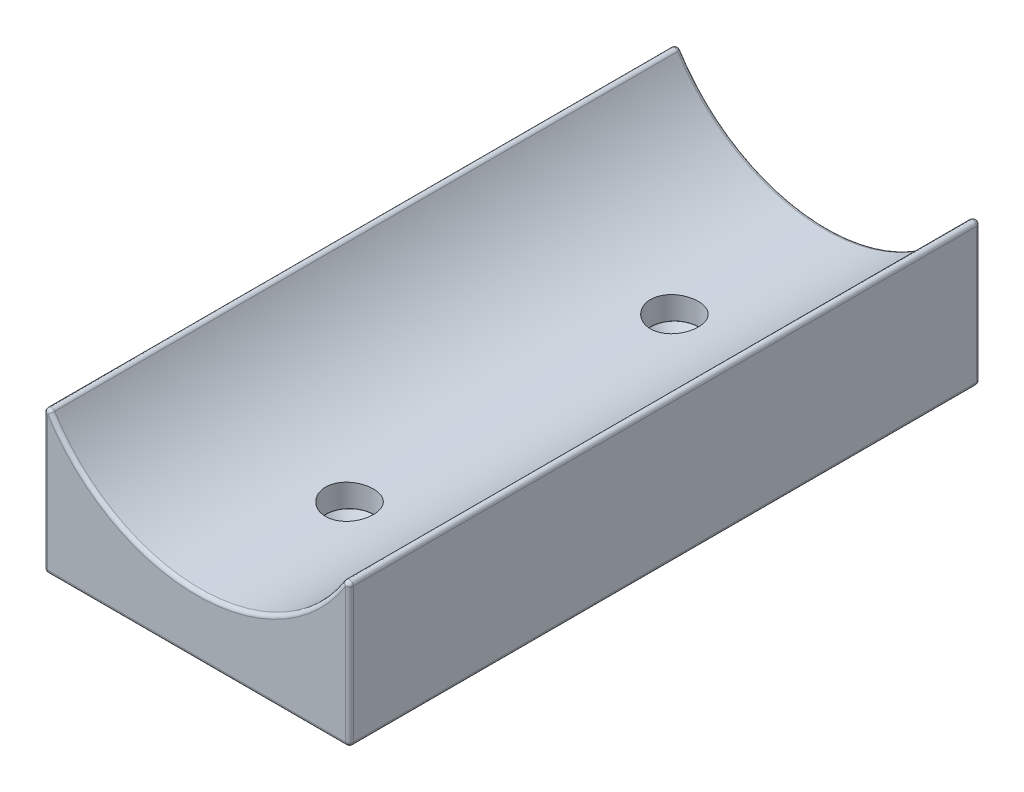
from build123d import *

# Parameters (mm, degrees)
BOSS_EXTRUDE1_DEPTH                                 = 83.82
FILLET1_R                                           = 0.508
CUT_EXTRUDE1_START                                  = 5.08
SKETCH5_R                                           = 3.175
CUT_EXTRUDE1_DEPTH                                  = 90.986026172
CSK_FOR_M3_COUNTERSUNK_FLAT_HEAD_SCREW1_D           = 3.6
CSK_FOR_M3_COUNTERSUNK_FLAT_HEAD_SCREW1_DEPTH       = 419.354
CSK_FOR_M3_COUNTERSUNK_FLAT_HEAD_SCREW1_CSINK_D     = 6.3
CSK_FOR_M3_COUNTERSUNK_FLAT_HEAD_SCREW1_CSINK_ANGLE = 90
CSK_FOR_M3_COUNTERSUNK_FLAT_HEAD_SCREW1_TIP         = 1.081549114
FILLET2_R                                           = 0.508


with BuildPart() as part:
    # Sketch2 → Boss-Extrude1 (new body)
    with BuildSketch(Plane.XY):
        with BuildLine():
            Line((0, 0), (40.64, 0))
            Line((40.64, 0), (40.64, 20.388311711))
            ThreePointArc((40.64, 20.388311711), (20.32, 8.001), (0, 20.388311711))
            Line((0, 20.388311711), (0, 0))
        make_face()
    extrude(amount=BOSS_EXTRUDE1_DEPTH)

    # Fillet1
    fillet1_edges = [part.edges().sort_by_distance(p)[0] for p in [
        (0, 20.388311711, 41.91),
        (40.64, 20.388311711, 41.91),
    ]]
    fillet(fillet1_edges, radius=FILLET1_R)

    # Sketch5 → Cut-Extrude1 (cut, through all)
    with BuildSketch(Plane(origin=(0, 0, 0), x_dir=(1, 0, 0), z_dir=(0, 1, 0)).offset(CUT_EXTRUDE1_START)):
        with Locations(Location((20.32, -20.32, 0), (0, 0, 90))):
            Circle(SKETCH5_R)
        with Locations(Location((20.32, -63.5, 0), (0, 0, 90))):
            Circle(SKETCH5_R)
    extrude(amount=CUT_EXTRUDE1_DEPTH, mode=Mode.SUBTRACT)

    # CSK for M3 Countersunk Flat Head Screw1
    with Locations(Plane(origin=(0, 5.08, 0), x_dir=(1, 0, 0), z_dir=(0, 1, 0))):
        with Locations((20.32, -20.32), (20.32, -63.5)):
            CounterSinkHole(CSK_FOR_M3_COUNTERSUNK_FLAT_HEAD_SCREW1_D / 2, CSK_FOR_M3_COUNTERSUNK_FLAT_HEAD_SCREW1_CSINK_D / 2, depth=CSK_FOR_M3_COUNTERSUNK_FLAT_HEAD_SCREW1_DEPTH, counter_sink_angle=CSK_FOR_M3_COUNTERSUNK_FLAT_HEAD_SCREW1_CSINK_ANGLE)
            with Locations((0, 0, -(CSK_FOR_M3_COUNTERSUNK_FLAT_HEAD_SCREW1_DEPTH + CSK_FOR_M3_COUNTERSUNK_FLAT_HEAD_SCREW1_TIP / 2))):  # 118° drill point
                Cone(0, CSK_FOR_M3_COUNTERSUNK_FLAT_HEAD_SCREW1_D / 2, CSK_FOR_M3_COUNTERSUNK_FLAT_HEAD_SCREW1_TIP, mode=Mode.SUBTRACT)

    # Fillet2
    fillet2_edges = [part.edges().sort_by_distance(p)[0] for p in [
        (40.64, 9.234774054, 83.82),
        (20.32, 8.001, 0),
        (20.32, 8.001, 83.82),
        (0, 9.234774054, 0),
        (0.36787397, 18.957839717, 0),
        (40.27212603, 18.957839717, 0),
        (0, 9.234774054, 83.82),
        (0.36787397, 18.957839717, 83.82),
        (40.27212603, 18.957839717, 83.82),
        (40.64, 9.234774054, 0),
        (20.32, 0, 0),
        (40.64, 0, 41.91),
        (0, 0, 41.91),
        (20.32, 0, 83.82),
    ]]
    fillet(fillet2_edges, radius=FILLET2_R)


solid = part.part
